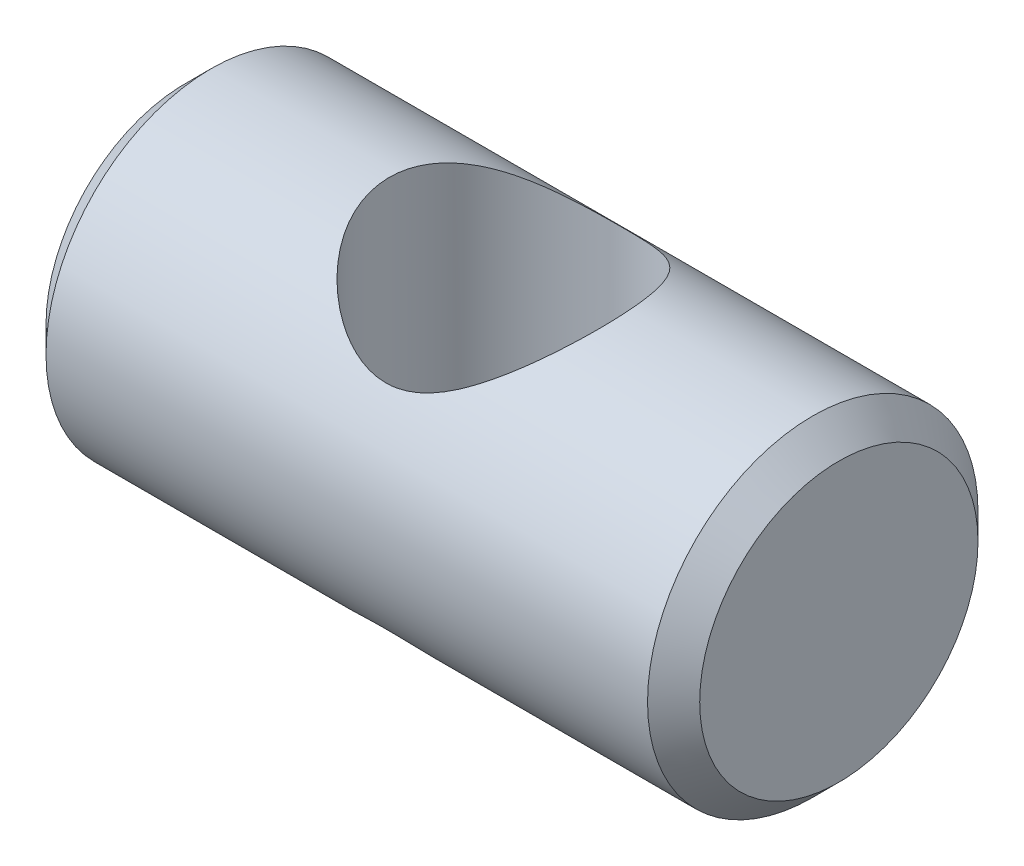
from build123d import *

# Parameters (mm, degrees)
SKETCH1_R           = 4.815
BOSS_EXTRUDE1_DEPTH = 9.525
CHAMFER1_SIZE       = 0.76
SKETCH2_R           = 3.43
CUT_EXTRUDE1_DEPTH  = 95.25


with BuildPart() as part:
    # Sketch1 → Boss-Extrude1 (new, symmetric)
    with BuildSketch(Plane(origin=(0, 0, 0), x_dir=(0, 0, -1), z_dir=(1, 0, 0))):
        with Locations(Location((0, 0, 0), (0, 0, 180))):
            Circle(SKETCH1_R)
    extrude(amount=BOSS_EXTRUDE1_DEPTH, both=True)

    # Chamfer1
    chamfer1_edges = [part.edges().sort_by_distance(p)[0] for p in [
        (-9.525, 0, -4.815),
        (9.525, 0, -4.815),
    ]]
    chamfer(chamfer1_edges, length=CHAMFER1_SIZE)

    # Sketch2 → Cut-Extrude1 (cut, symmetric)
    with BuildSketch(Plane(origin=(0, 0, 0), x_dir=(1, 0, 0), z_dir=(0, 1, 0))):
        with Locations(Location((0, -0.25, 0), (0, 0, 270))):
            Circle(SKETCH2_R)
    extrude(amount=CUT_EXTRUDE1_DEPTH, both=True, mode=Mode.SUBTRACT)


solid = part.part
